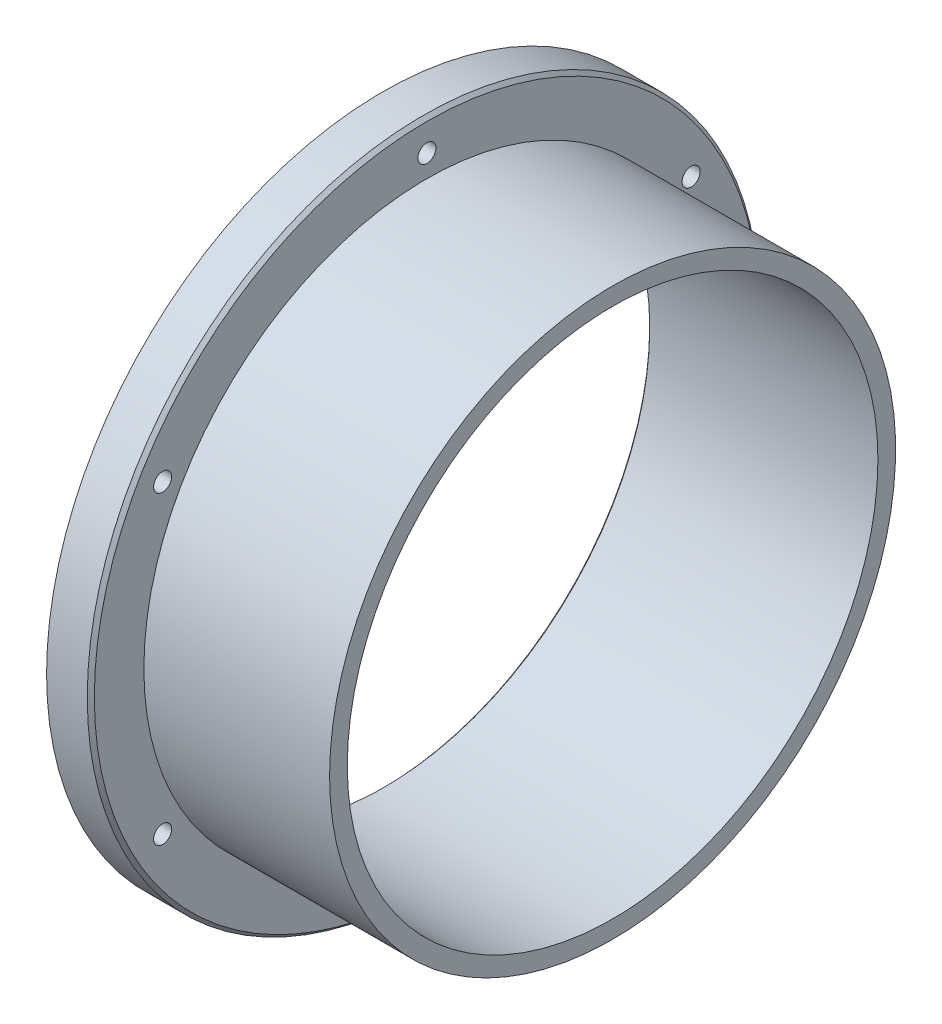
from build123d import *

# Parameters (mm, degrees)
CHAMFER_1_SIZE           = 2
CHAMFER_2_SIZE           = 1
PATTERN_CIRCULAR_1_COUNT = 6


with BuildPart() as part:
    # Эскиз1 → Повернуть1 (revolve)
    with BuildSketch(Plane.XY, mode=Mode.PRIVATE) as revolve_1_sk:
        Polygon((-118.03030303, 150), (11.96969697, 150), (11.96969697, 160), (-93.03030303, 160), (-93.03030303, 190), (-118.03030303, 190), align=None)
    revolve(revolve_1_sk.sketch.rotate(Axis((-311.484848485, 0, 0), (1, 0, 0)), 90), axis=Axis((-311.484848485, 0, 0), (1, 0, 0)))

    # Фаска1
    chamfer_1_edges = [part.edges().sort_by_distance(p)[0] for p in [
        (-93.03030303, 0, -190),
    ]]
    chamfer(chamfer_1_edges, length=CHAMFER_1_SIZE)

    # Фаска2
    chamfer_2_edges = [part.edges().sort_by_distance(p)[0] for p in [
        (-118.03030303, 0, -150),
    ]]
    chamfer(chamfer_2_edges, length=CHAMFER_2_SIZE)

    # Эскиз6 → Отверстие обработанное метчиком M121 (revolve, cut)
    with BuildSketch(Plane(origin=(-118.03030303, 172.5, 0), x_dir=(0, 0, 1), z_dir=(0, 1, 0))):
        Polygon((0, 0), (0, 35.814389157), (5.1, 32.75), (5.1, 0), align=None)
    hole_wizard_m121 = revolve(axis=Axis((-124.38030303, 172.5, 0), (1, 0, 0)), mode=Mode.SUBTRACT)

    # Круговой массив1: Отверстие обработанное метчиком M121 ×6 about axis
    pattern_circular_1_axis = Axis((0, 0, 0), (1, 0, 0))
    for i in range(1, PATTERN_CIRCULAR_1_COUNT):
        add(hole_wizard_m121.rotate(pattern_circular_1_axis, i * 360 / PATTERN_CIRCULAR_1_COUNT), mode=Mode.SUBTRACT)


solid = part.part
